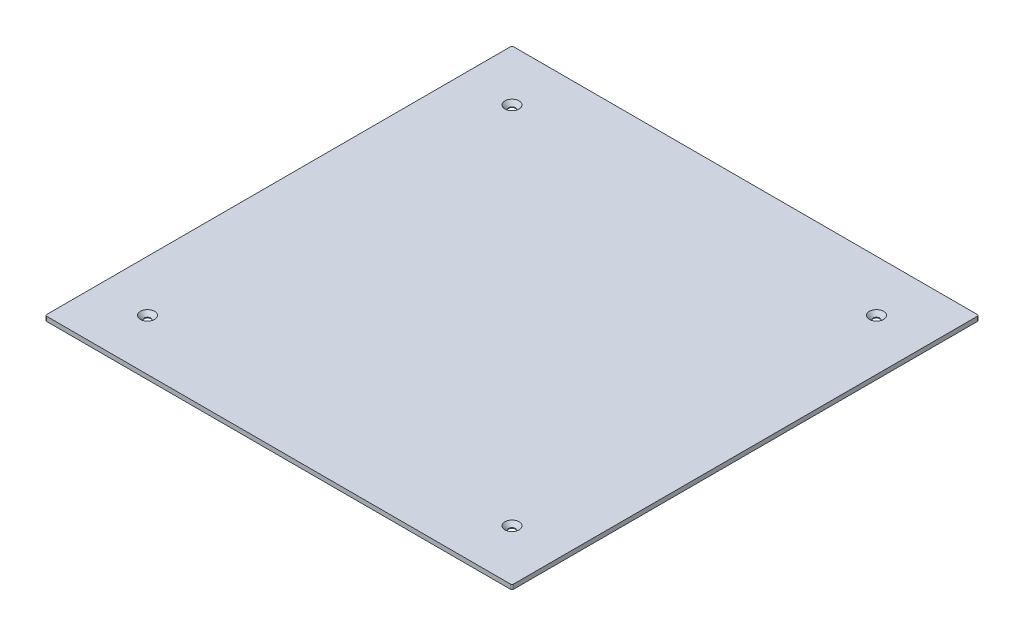
from build123d import *

# Parameters (mm, degrees)
SZKIC1_W                                    = 310
SZKIC1_H                                    = 310
DODANIE_WYCI_GNI_CIE1_DEPTH                 = 3
ZAOKR_GLENIE1_R                             = 1
POG_BIENIE_STO_KOWE_POD_M4_WKR_T_DO_2_COUNT = 2
POG_BIENIE_STO_KOWE_POD_M4_WKR_T_DO_2_PITCH = 242
POG_BIENIE_STO_KOWE_POD_M4_WKR_T_DO_3_COUNT = 2
POG_BIENIE_STO_KOWE_POD_M4_WKR_T_DO_3_PITCH = 342.239682094
POG_BIENIE_STO_KOWE_POD_M4_WKR_T_DO_4_COUNT = 2
POG_BIENIE_STO_KOWE_POD_M4_WKR_T_DO_4_PITCH = 242


with BuildPart() as part:
    # Szkic1 → Dodanie-wyciągnięcie1 (new body)
    with BuildSketch(Plane(origin=(0, 0, 0), x_dir=(1, 0, 0), z_dir=(0, 1, 0))):
        with Locations((155, 155)):
            Rectangle(SZKIC1_W, SZKIC1_H)
    extrude(amount=DODANIE_WYCI_GNI_CIE1_DEPTH)

    # Zaokrąglenie1
    zaokr_glenie1_edges = [part.edges().sort_by_distance(p)[0] for p in [
        (0, 1.5, -310),
        (310, 1.5, -310),
        (310, 1.5, 0),
        (0, 1.5, 0),
    ]]
    fillet(zaokr_glenie1_edges, radius=ZAOKR_GLENIE1_R)

    # Szkic3 → Pogłębienie stożkowe pod M4 wkręt do części metalowych z łbem soczewkowym1 (revolve, cut)
    with BuildSketch(Plane(origin=(34, 3, -276), x_dir=(0, 0, 1), z_dir=(1, 0, 0))):
        Polygon((0, 0), (0, 3), (2.15, 3), (2.15, 2.55), (4.7, 0), align=None)
    pog_bienie_sto_kowe_pod_m4_wkr_t_do_cz_c = revolve(axis=Axis((34, 9.35, -276), (0, -1, 0)), mode=Mode.SUBTRACT)

    # Pog_bienie sto_kowe pod M4 wkr_t do  2: Pogłębienie stożkowe pod M4 wkręt do części metalowych z łbem soczewkowym1 ×2
    with Locations(*[(0, 0, i * POG_BIENIE_STO_KOWE_POD_M4_WKR_T_DO_2_PITCH) for i in range(1, POG_BIENIE_STO_KOWE_POD_M4_WKR_T_DO_2_COUNT)]):
        add(pog_bienie_sto_kowe_pod_m4_wkr_t_do_cz_c, mode=Mode.SUBTRACT)

    # Pog_bienie sto_kowe pod M4 wkr_t do  3: Pogłębienie stożkowe pod M4 wkręt do części metalowych z łbem soczewkowym1 ×2
    with Locations(*[Vector(0.7071067811865476, 0, 0.7071067811865475) * (i * POG_BIENIE_STO_KOWE_POD_M4_WKR_T_DO_3_PITCH) for i in range(1, POG_BIENIE_STO_KOWE_POD_M4_WKR_T_DO_3_COUNT)]):
        add(pog_bienie_sto_kowe_pod_m4_wkr_t_do_cz_c, mode=Mode.SUBTRACT)

    # Pog_bienie sto_kowe pod M4 wkr_t do  4: Pogłębienie stożkowe pod M4 wkręt do części metalowych z łbem soczewkowym1 ×2
    with Locations(*[(i * POG_BIENIE_STO_KOWE_POD_M4_WKR_T_DO_4_PITCH, 0, 0) for i in range(1, POG_BIENIE_STO_KOWE_POD_M4_WKR_T_DO_4_COUNT)]):
        add(pog_bienie_sto_kowe_pod_m4_wkr_t_do_cz_c, mode=Mode.SUBTRACT)


solid = part.part
